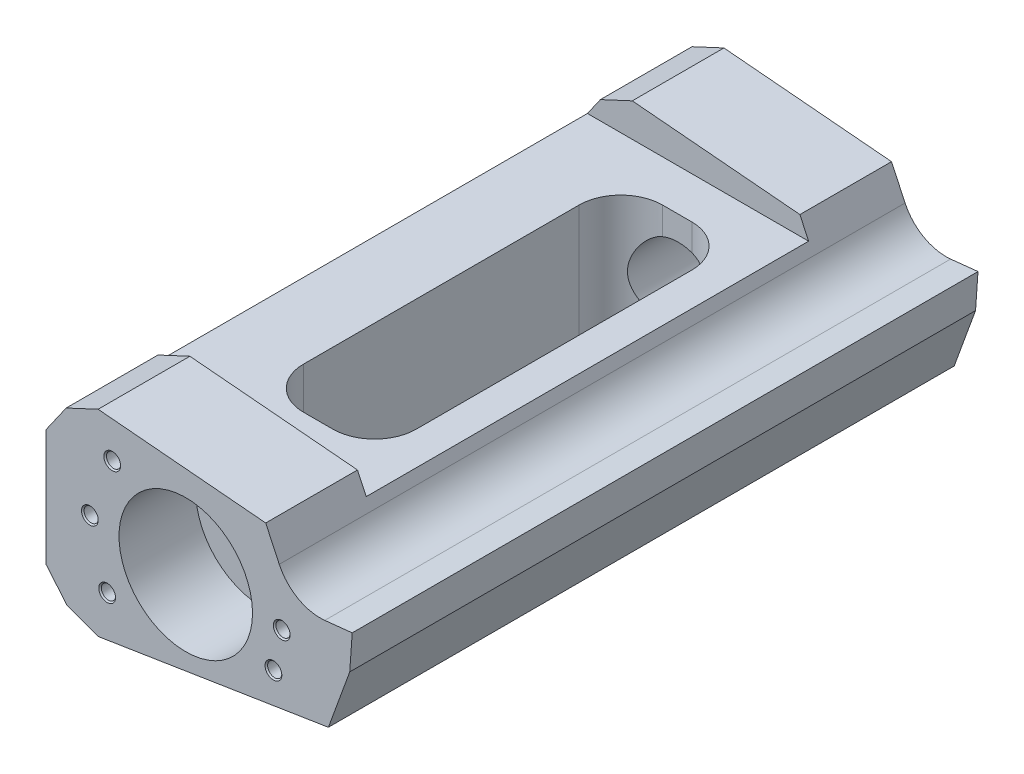
from build123d import *

# Parameters (mm, degrees)
RESSALTO_EXTRUS_O1_DEPTH             = 250
ESCALA1_SCALE                        = 1.5
AL_VIOS_SUPERIOR_INFERIOR_DEPTH      = 0.1
AL_VIOS_SUPERIOR_INFERIOR_DEPTH_BACK = 265
AL_VIOS_SUPERIOR_INFERIOR_START      = -55
AL_VIO_CENTRAL_DEPTH                 = 342.991467302
ESBO_O7_R                            = 40
REBAIXO_ROLAMENTO_PAI_DEPTH          = 46
ESBO_O7_3_R                          = 25
REBAIXO_ROLAMENTO_FILHO_DEPTH        = 395.297005295
FURO_START                           = -329
FURO_EIXO_ARMA_FILHO_DEPTH           = 46
FUROS_POLIA_PAI_D                    = 8.5
FUROS_POLIA_PAI_DEPTH                = 27.5
FUROS_POLIA_PAI_CSINK_D              = 10.05
FUROS_POLIA_PAI_CSINK_ANGLE          = 90
FUROS_POLIA_PAI_TIP                  = 2.553657631
FUROS_POLIA_FILHO_D                  = 8.5
FUROS_POLIA_FILHO_DEPTH              = 27.5
FUROS_POLIA_FILHO_CSINK_D            = 10.05
FUROS_POLIA_FILHO_CSINK_ANGLE        = 90
FUROS_POLIA_FILHO_TIP                = 2.553657631


with BuildPart() as part:
    # Esboço1 → Ressalto-extrusão1 (new body)
    with BuildSketch(Plane.XY):
        with BuildLine():
            Line((64.316370752, 0), (63.337395385, -14))
            Line((63.337395385, -14), (54.810070893, -37.42863149))
            Line((54.810070893, -37.42863149), (-37.189929107, -52))
            Line((-37.189929107, -52), (-49.547157766, -47.50233659))
            Line((-49.547157766, -47.50233659), (-58, -37.42863149))
            Line((-58, -37.42863149), (-58, 9.144452309))
            Line((-58, 9.144452309), (-49.934391816, 20.66333456))
            Line((-49.934391816, 20.66333456), (-37.189929107, 26.60617512))
            Line((-37.189929107, 26.60617512), (29.770815295, 20.747869084))
            Line((29.770815295, 20.747869084), (35.181577398, 9.144452309))
            ThreePointArc((35.181577398, 9.144452309), (42.631493482, 1.085178494), (53.376629903, -1.149813096))
            Line((53.376629903, -1.149813096), (64.316370752, 0))
        make_face()
    extrude(amount=RESSALTO_EXTRUS_O1_DEPTH)


with BuildPart() as part_1:
    # Escala1: scaled about (-4.187287107, -12.759804583, 125)
    add(part.part.scale(ESCALA1_SCALE).moved(Location((2.093643554, 6.379902291, -62.5))))

    # Esboço4 → Alívios superior / inferior (cut, two sides: drawn at the far end of the back side and taken through both)
    with BuildSketch(Plane(origin=(0, 0, -62.5), x_dir=(-1, 0, 0), z_dir=(0, 0, -1)).offset(AL_VIOS_SUPERIOR_INFERIOR_START - AL_VIOS_SUPERIOR_INFERIOR_DEPTH_BACK)):
        Polygon((-46.749866496, 37.501705917), (-51.978360206, 26.289164972), (80.570262297, 26.289164972), (72.807944171, 37.374904131), (53.691250107, 46.289164972), align=None)
        Polygon((72.227093095, -64.873602594), (84.906356446, -49.763044944), (-84.308749893, -49.763044944), (53.691250107, -71.620097709), align=None)
    extrude(amount=AL_VIOS_SUPERIOR_INFERIOR_DEPTH + AL_VIOS_SUPERIOR_INFERIOR_DEPTH_BACK, mode=Mode.SUBTRACT)

    # Esboço15 → Alívio Central (cut, through all)
    with BuildSketch(Plane(origin=(0, 26.289164972, 0), x_dir=(1, 0, 0), z_dir=(0, 1, 0))):
        with BuildLine():
            Line((-10.570262297, -17.4), (6.978360206, -17.4))
            ThreePointArc((6.978360206, -17.4), (24.656029736, -24.72233047), (31.978360206, -42.4))
            Line((31.978360206, -42.4), (31.978360206, -207.5))
            ThreePointArc((31.978360206, -207.5), (24.656029736, -225.17766953), (6.978360206, -232.5))
            Line((6.978360206, -232.5), (-10.570262297, -232.5))
            ThreePointArc((-10.570262297, -232.5), (-28.247931827, -225.17766953), (-35.570262297, -207.5))
            Line((-35.570262297, -207.5), (-35.570262297, -42.4))
            ThreePointArc((-35.570262297, -42.4), (-28.247931827, -24.72233047), (-10.570262297, -17.4))
        make_face()
    extrude(amount=-AL_VIO_CENTRAL_DEPTH, mode=Mode.SUBTRACT)

    # Esboço7 → Rebaixo rolamento (Pai) (cut)
    with BuildSketch(Plane.XY.offset(312.5)):
        with Locations((-1.158298377, -13.283920248)):
            Circle(ESBO_O7_R)
    extrude(amount=-REBAIXO_ROLAMENTO_PAI_DEPTH, mode=Mode.SUBTRACT)

    # Esboço7<3> → Rebaixo rolamento (Filho) (cut, through all)
    with BuildSketch(Plane.XY.offset(312.5)):
        with Locations((-1.158298377, -13.283920248)):
            Circle(ESBO_O7_3_R)
    extrude(amount=-REBAIXO_ROLAMENTO_FILHO_DEPTH, mode=Mode.SUBTRACT)

    # Esboço7 → Furo eixo arma (Filho) (cut)
    with BuildSketch(Plane.XY.offset(312.5).offset(FURO_START)):
        with Locations((-1.158298377, -13.283920248)):
            Circle(ESBO_O7_R)
    extrude(amount=-FURO_EIXO_ARMA_FILHO_DEPTH, mode=Mode.SUBTRACT)

    # Furos Polia (Pai)
    with Locations(Plane.XY.offset(312.5)):
        with Locations((56.341701623, -13.283920248), (-45.205853857, 23.676367309), (-58.623505242, -11.283920248), (-48.259540924, -46.264565338), (51.370565437, -36.671277225)):
            CounterSinkHole(FUROS_POLIA_PAI_D / 2, FUROS_POLIA_PAI_CSINK_D / 2, depth=FUROS_POLIA_PAI_DEPTH, counter_sink_angle=FUROS_POLIA_PAI_CSINK_ANGLE)
            with Locations((0, 0, -(FUROS_POLIA_PAI_DEPTH + FUROS_POLIA_PAI_TIP / 2))):  # 118° drill point
                Cone(0, FUROS_POLIA_PAI_D / 2, FUROS_POLIA_PAI_TIP, mode=Mode.SUBTRACT)

    # Furos Polia (Filho)
    with Locations(Plane(origin=(0, 0, -62.5), x_dir=(-1, 0, 0), z_dir=(0, 0, -1))):
        with Locations((45.205853857, 23.676367309), (58.623505242, -11.283920248), (48.259540924, -46.264565338), (-51.370565437, -36.671277225), (-56.341701623, -13.283920248)):
            CounterSinkHole(FUROS_POLIA_FILHO_D / 2, FUROS_POLIA_FILHO_CSINK_D / 2, depth=FUROS_POLIA_FILHO_DEPTH, counter_sink_angle=FUROS_POLIA_FILHO_CSINK_ANGLE)
            with Locations((0, 0, -(FUROS_POLIA_FILHO_DEPTH + FUROS_POLIA_FILHO_TIP / 2))):  # 118° drill point
                Cone(0, FUROS_POLIA_FILHO_D / 2, FUROS_POLIA_FILHO_TIP, mode=Mode.SUBTRACT)


solid = part_1.part
